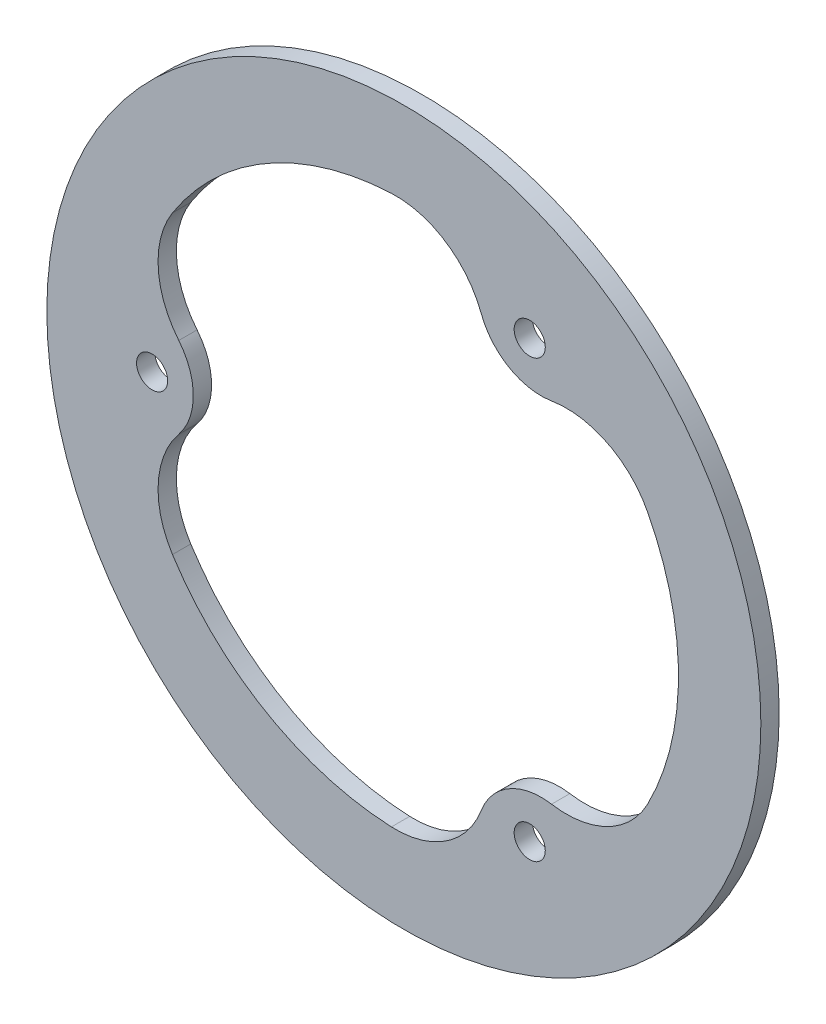
from build123d import *

# Parameters (mm, degrees)
SKETCH_1_R        = 39
EXTRUDE_1_DEPTH   = 2
FILLET_1_R        = 10
HOLE_WIZARD_M31_D = 3.4


with BuildPart() as part:
    # Эскиз1 → Бобышка-Вытянуть1 (new body)
    with BuildSketch(Plane.XY):
        Circle(SKETCH_1_R)
        with BuildLine():
            ThreePointArc((20.612446655, -21.797409087), (30, 0), (20.612446655, 21.797409087))
            ThreePointArc((20.612446655, 21.797409087), (11.5, 19.918584287), (8.570886678, 28.749606981))
            ThreePointArc((8.570886678, 28.749606981), (-15, 25.980762114), (-29.183333333, 6.952197894))
            ThreePointArc((-29.183333333, 6.952197894), (-23, 0), (-29.183333333, -6.952197894))
            ThreePointArc((-29.183333333, -6.952197894), (-15, -25.980762114), (8.570886678, -28.749606981))
            ThreePointArc((8.570886678, -28.749606981), (11.5, -19.918584287), (20.612446655, -21.797409087))
        make_face(mode=Mode.SUBTRACT)
    extrude(amount=EXTRUDE_1_DEPTH)

    # Скругление1
    fillet_1_edges = [part.edges().sort_by_distance(p)[0] for p in [
        (-29.183333333, 6.952197894, 1),
        (-29.183333333, -6.952197894, 1),
        (8.570886678, -28.749606981, 1),
        (20.612446655, -21.797409087, 1),
        (20.612446655, 21.797409087, 1),
        (8.570886678, 28.749606981, 1),
    ]]
    fillet(fillet_1_edges, radius=FILLET_1_R)

    # Отверстие с зазором M31 (through all)
    with Locations(Plane.XY.offset(2)):
        with Locations((13.75, 23.815698604), (-27.5, 0), (13.75, -23.815698604)):
            Hole(HOLE_WIZARD_M31_D / 2)


solid = part.part
